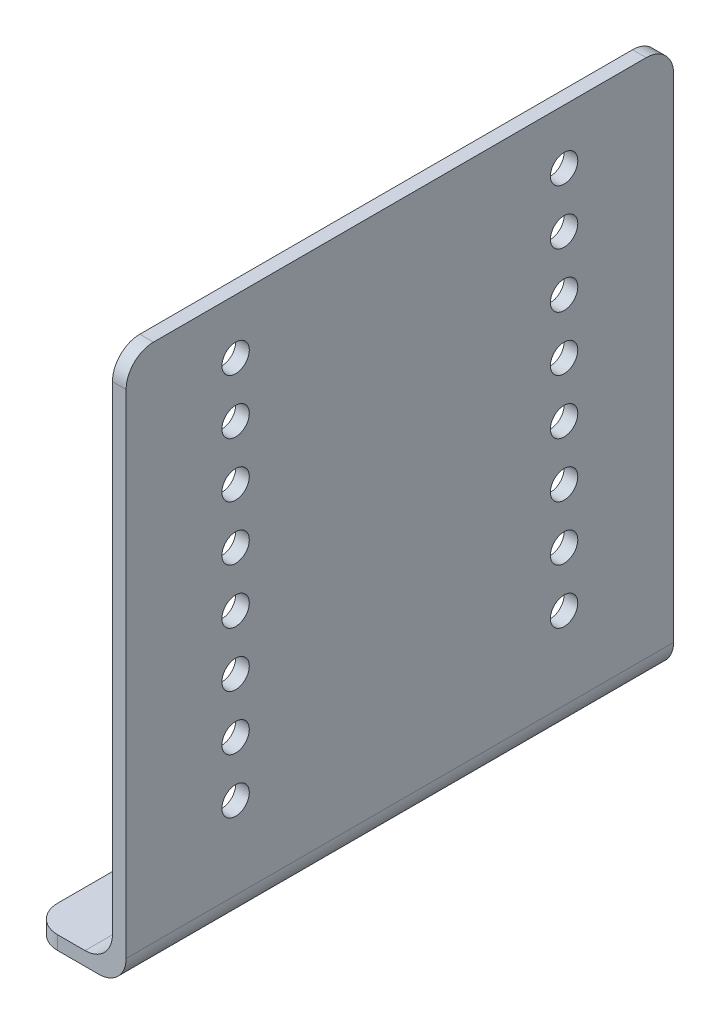
from build123d import *

# Parameters (mm, degrees)
SKETCH1_R           = 5
BOSS_EXTRUDE1_DEPTH = 5
SKETCH3_W           = 199.496057237
SKETCH3_H           = 5
BOSS_EXTRUDE2_DEPTH = 30
FILLET1_R           = 10
BOSS_EXTRUDE3_DEPTH = 200
FILLET2_R           = 10
SKETCH8_R           = 5
CUT_EXTRUDE1_DEPTH  = 200


with BuildPart() as part:
    # Sketch1 → Boss-Extrude1 (new body)
    with BuildSketch(Plane(origin=(0, 0, 0), x_dir=(0, 0, -1), z_dir=(1, 0, 0))):
        with BuildLine():
            Line((0, 0), (200, 0))
            Line((200, 0), (200, 190))
            ThreePointArc((200, 190), (197.071067812, 197.071067812), (190, 200))
            Line((190, 200), (10, 200))
            ThreePointArc((10, 200), (2.928932188, 197.071067812), (0, 190))
            Line((0, 190), (0, 0))
        make_face()
        with Locations((40, 40)):
            Circle(SKETCH1_R, mode=Mode.SUBTRACT)
        with Locations((40, 60)):
            Circle(SKETCH1_R, mode=Mode.SUBTRACT)
        with Locations((40, 80)):
            Circle(SKETCH1_R, mode=Mode.SUBTRACT)
        with Locations((40, 100)):
            Circle(SKETCH1_R, mode=Mode.SUBTRACT)
        with Locations((40, 120)):
            Circle(SKETCH1_R, mode=Mode.SUBTRACT)
        with Locations((40, 140)):
            Circle(SKETCH1_R, mode=Mode.SUBTRACT)
        with Locations((40, 160)):
            Circle(SKETCH1_R, mode=Mode.SUBTRACT)
        with Locations((40, 180)):
            Circle(SKETCH1_R, mode=Mode.SUBTRACT)
        with Locations((160, 180)):
            Circle(SKETCH1_R, mode=Mode.SUBTRACT)
        with Locations((160, 40)):
            Circle(SKETCH1_R, mode=Mode.SUBTRACT)
        with Locations((160, 80)):
            Circle(SKETCH1_R, mode=Mode.SUBTRACT)
        with Locations((160, 60)):
            Circle(SKETCH1_R, mode=Mode.SUBTRACT)
        with Locations((160, 100)):
            Circle(SKETCH1_R, mode=Mode.SUBTRACT)
        with Locations((160, 120)):
            Circle(SKETCH1_R, mode=Mode.SUBTRACT)
        with Locations((160, 140)):
            Circle(SKETCH1_R, mode=Mode.SUBTRACT)
        with Locations((160, 160)):
            Circle(SKETCH1_R, mode=Mode.SUBTRACT)
    extrude(amount=BOSS_EXTRUDE1_DEPTH)

    # Sketch3 → Boss-Extrude2 (add)
    with BuildSketch(Plane.ZY):
        with Locations((-99.748028619, 2.5)):
            Rectangle(SKETCH3_W, SKETCH3_H)
    extrude(amount=BOSS_EXTRUDE2_DEPTH)

    # Fillet1
    fillet1_edges = [part.edges().sort_by_distance(p)[0] for p in [
        (5, 0, -100),
    ]]
    fillet(fillet1_edges, radius=FILLET1_R)

    # Sketch7 → Boss-Extrude3 (add)
    with BuildSketch(Plane.XY):
        with BuildLine():
            Line((0, 15), (0, 5))
            Line((0, 5), (-10, 5))
            ThreePointArc((-10, 5), (-2.928932188, 7.928932188), (0, 15))
        make_face()
    extrude(amount=-BOSS_EXTRUDE3_DEPTH)

    # Fillet2
    fillet2_edges = [part.edges().sort_by_distance(p)[0] for p in [
        (-30, 2.5, -199.496057237),
        (-30, 2.5, 0),
    ]]
    fillet(fillet2_edges, radius=FILLET2_R)

    # Sketch8 → Cut-Extrude1 (cut)
    with BuildSketch(Plane(origin=(0, 5, 0), x_dir=(1, 0, 0), z_dir=(0, 1, 0))):
        with Locations(Location((-20, 169.496057237, 0), (0, 0, 270))):
            Circle(SKETCH8_R)
        with Locations(Location((-20, 29.496057237, 0), (0, 0, 270))):
            Circle(SKETCH8_R)
    extrude(amount=-CUT_EXTRUDE1_DEPTH, mode=Mode.SUBTRACT)


solid = part.part
